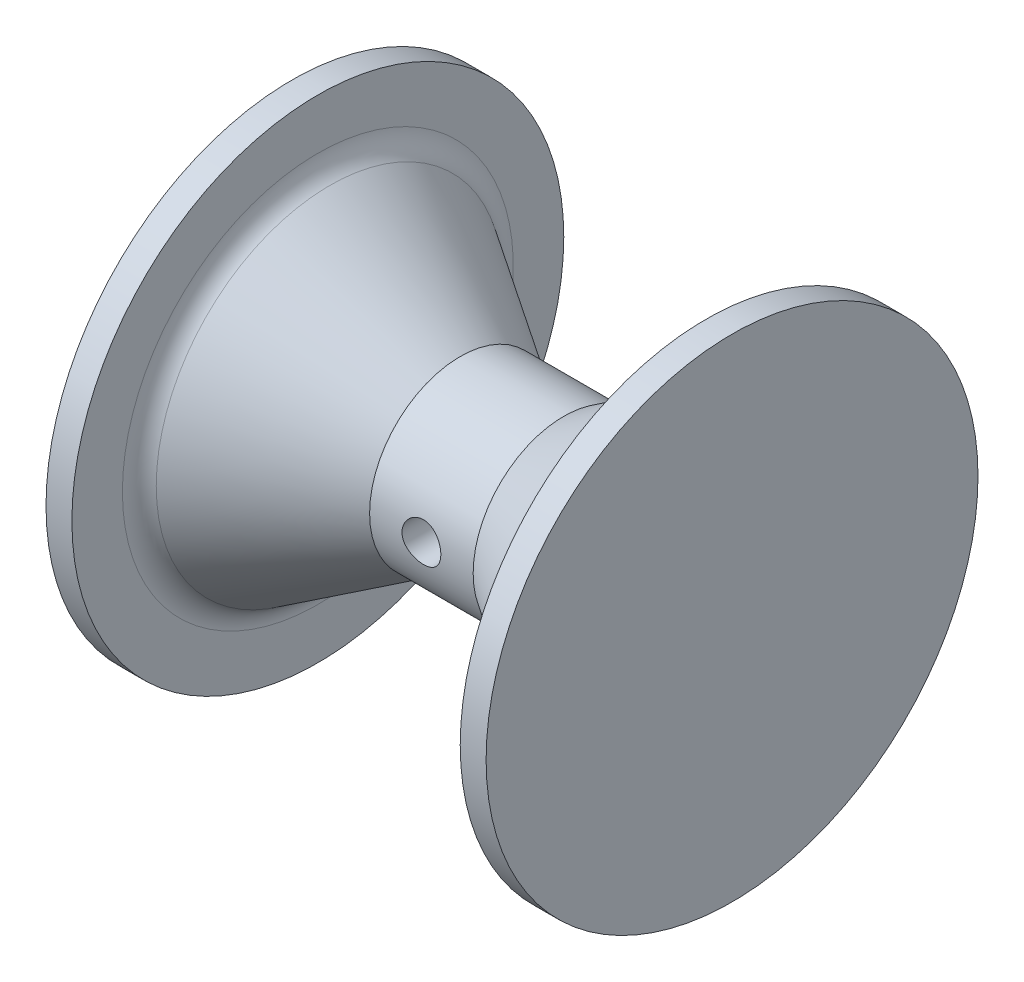
from build123d import *

# Parameters (mm, degrees)
MOTOR_SHAFT_DEPTH  = 13
SKETCH4_R          = 1.5
STRING_HOLES_DEPTH = 17.5
FILLET1_R          = 2


with BuildPart() as part:
    # Sketch2 → Revolve1 (revolve)
    with BuildSketch(Plane.XY, mode=Mode.PRIVATE) as revolve1_sk:
        Polygon((15, 14), (15, 19), (17, 19), (17, 0), (-17, 0), (-17, 19), (-15, 19), (-15, 14), (-4, 7), (4, 7), align=None)
    revolve(revolve1_sk.sketch.rotate(Axis((0, 0, 0), (1, 0, 0)), 90), axis=Axis((0, 0, 0), (1, 0, 0)))

    # Sketch3 → motor shaft (cut)
    with BuildSketch(Plane.ZY.offset(17)):
        with BuildLine():
            Line((2.9, 1.574801575), (2.9, -1.574801575))
            ThreePointArc((2.9, -1.574801575), (-3.3, 0), (2.9, 1.574801575))
        make_face()
    extrude(amount=-MOTOR_SHAFT_DEPTH, mode=Mode.SUBTRACT)

    # Sketch4 → string holes (cut, symmetric)
    with BuildSketch(Plane.XY):
        Circle(SKETCH4_R)
    extrude(amount=STRING_HOLES_DEPTH, both=True, mode=Mode.SUBTRACT)

    # Fillet1
    fillet1_edges = [part.edges().sort_by_distance(p)[0] for p in [
        (15, 0, -14),
        (-15, 0, -14),
    ]]
    fillet(fillet1_edges, radius=FILLET1_R)


solid = part.part
